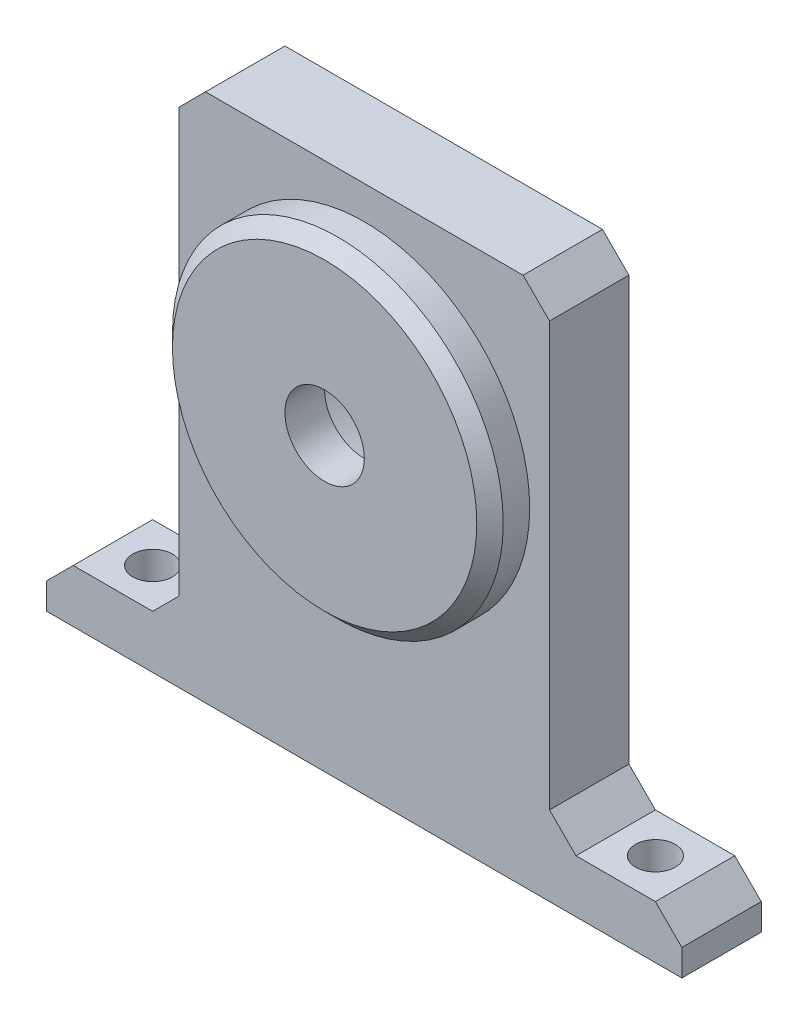
from build123d import *

# Parameters (mm, degrees)
SKETCH1_W           = 28
SKETCH1_H           = 40
SKETCH1_R           = 9.5
BOSS_EXTRUDE1_DEPTH = 6
SKETCH2_W           = 10
SKETCH2_H           = 6
BOSS_EXTRUDE2_DEPTH = 4
CHAMFER1_SIZE       = 2
SKETCH3_R           = 1.5
CUT_EXTRUDE1_DEPTH  = 53.687759489
SKETCH4_R           = 12.5
SKETCH4_R_2         = 3
BOSS_EXTRUDE3_DEPTH = 3
CHAMFER2_SIZE       = 1


with BuildPart() as part:
    # Sketch1 → Boss-Extrude1 (new body)
    with BuildSketch(Plane.XY):
        with Locations((14, 20)):
            Rectangle(SKETCH1_W, SKETCH1_H)
        with Locations((14, 25)):
            Circle(SKETCH1_R, mode=Mode.SUBTRACT)
    extrude(amount=BOSS_EXTRUDE1_DEPTH)

    # Sketch2 → Boss-Extrude2 (add)
    with BuildSketch(Plane(origin=(0, 0, 0), x_dir=(1, 0, 0), z_dir=(0, 1, 0))):
        with Locations((-5, -3)):
            Rectangle(SKETCH2_W, SKETCH2_H)
        with Locations((33, -3)):
            Rectangle(SKETCH2_W, SKETCH2_H)
    extrude(amount=BOSS_EXTRUDE2_DEPTH)

    # Chamfer1
    chamfer1_edges = [part.edges().sort_by_distance(p)[0] for p in [
        (0, 4, 3),
        (-10, 4, 3),
        (28, 4, 3),
        (38, 4, 3),
        (0, 40, 3),
        (28, 40, 3),
    ]]
    chamfer(chamfer1_edges, length=CHAMFER1_SIZE)

    # Sketch3 → Cut-Extrude1 (cut, through all)
    with BuildSketch(Plane(origin=(0, 4, 0), x_dir=(1, 0, 0), z_dir=(0, 1, 0))):
        with Locations(Location((-5, -3, 0), (0, 0, 270))):
            Circle(SKETCH3_R)
        with Locations(Location((33, -3, 0), (0, 0, 270))):
            Circle(SKETCH3_R)
    extrude(amount=-CUT_EXTRUDE1_DEPTH, mode=Mode.SUBTRACT)

    # Sketch4 → Boss-Extrude3 (add)
    with BuildSketch(Plane.XY.offset(6)):
        with Locations((14, 25)):
            Circle(SKETCH4_R)
        with Locations((14, 25)):
            Circle(SKETCH4_R_2, mode=Mode.SUBTRACT)
    extrude(amount=BOSS_EXTRUDE3_DEPTH)

    # Chamfer2
    chamfer2_edges = [part.edges().sort_by_distance(p)[0] for p in [
        (1.5, 25, 9),
    ]]
    chamfer(chamfer2_edges, length=CHAMFER2_SIZE)


solid = part.part
